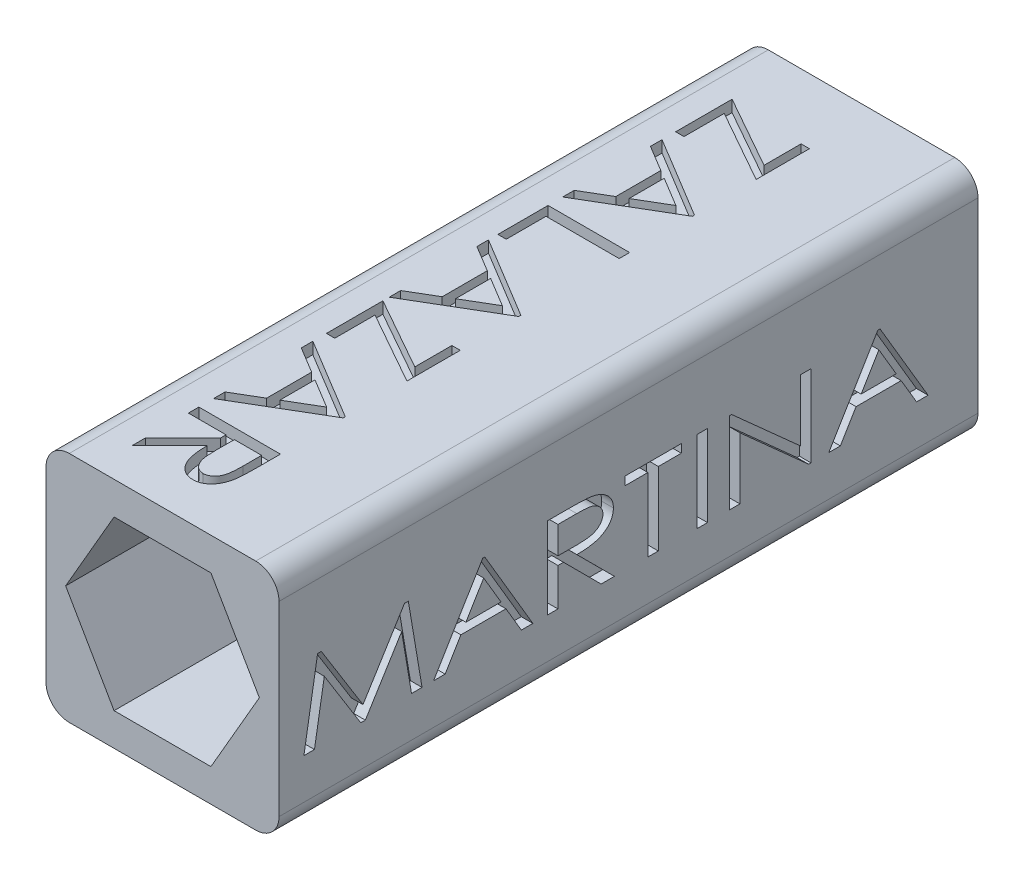
from build123d import *

# Parameters (mm, degrees)
CROQUIS1_W              = 30
CROQUIS1_H              = 10
SALIENTE_EXTRUIR1_DEPTH = 5
REDONDEO2_R             = 1
CORTAR_EXTRUIR3_DEPTH   = 16.5
CROQUIS6_W              = 0.448717949
CROQUIS6_H              = 3.5
CORTAR_EXTRUIR4_DEPTH   = 0.5
CORTAR_EXTRUIR5_DEPTH   = 0.5
CROQUIS9_W              = 0.448717949
CROQUIS9_H              = 3.5
CORTAR_EXTRUIR8_DEPTH   = 0.5
CORTAR_EXTRUIR9_DEPTH   = 0.5


with BuildPart() as part:
    # Croquis1 → Saliente-Extruir1 (new, symmetric)
    with BuildSketch(Plane(origin=(0, 0, 0), x_dir=(0, 0, -1), z_dir=(1, 0, 0))):
        Rectangle(CROQUIS1_W, CROQUIS1_H)
    extrude(amount=SALIENTE_EXTRUIR1_DEPTH, both=True)

    # Redondeo2
    redondeo2_edges = [part.edges().sort_by_distance(p)[0] for p in [
        (5, -5, 0),
        (-5, -5, 0),
        (-5, 5, 0),
        (5, 5, 0),
    ]]
    fillet(redondeo2_edges, radius=REDONDEO2_R)

    # Croquis5 → Cortar-Extruir3 (cut, symmetric)
    with BuildSketch(Plane.XY):
        Polygon((4.156921938, 0), (2.078460969, 3.6), (-2.078460969, 3.6), (-4.156921938, 0), (-2.078460969, -3.6), (2.078460969, -3.6), align=None)
    extrude(amount=CORTAR_EXTRUIR3_DEPTH, both=True, mode=Mode.SUBTRACT)

    # Croquis6 → Cortar-Extruir4 (cut)
    # profile 1 of 7: a face of its own
    with BuildSketch(Plane(origin=(5, 0, 0), x_dir=(0, 0, -1), z_dir=(1, 0, 0))):
        Polygon((-13.930690227, -2.26543463), (-13.343150163, 1.23456537), (-13.183995516, 1.23456537), (-11.395433817, -1.637229501), (-9.613883336, 1.23456537), (-9.449119715, 1.23456537), (-8.860177407, -2.26543463), (-9.312400965, -2.26543463), (-9.735177407, 0.247385883), (-11.293771157, -2.26543463), (-11.490085259, -2.26543463), (-13.055690227, 0.247385883), (-13.477765548, -2.26543463), align=None)
    # profile 2 of 7: a face of its own
    with BuildSketch(Plane(origin=(5, 0, 0), x_dir=(0, 0, -1), z_dir=(1, 0, 0))):
        Polygon((-6.167869715, 1.23456537), (-4.10376715, -2.26543463), (-4.598058016, -2.26543463), (-5.25991699, -1.143639758), (-7.1936109, -1.143639758), (-7.870193433, -2.26543463), (-8.366587663, -2.26543463), (-6.257613304, 1.23456537), align=None)
        Polygon((-6.216247118, 0.478756076), (-6.977665388, -0.784665399), (-5.47095465, -0.784665399), align=None, mode=Mode.SUBTRACT)
    # profile 3 of 7: a face of its own
    with BuildSketch(Plane(origin=(5, 0, 0), x_dir=(0, 0, -1), z_dir=(1, 0, 0))):
        with BuildLine():
            Line((-3.475562022, 1.23456537), (-2.575321638, 1.23456537))
            add(Edge.make_bspline(
                [(-2.575321638, 1.23456537), (-2.515025397, 1.234411626), (-2.399570414, 1.234117236), (-2.234079306, 1.232434592), (-2.083825924, 1.227675496), (-1.948676376, 1.223568584), (-1.828815457, 1.216068884), (-1.724013773, 1.208946876), (-1.634402865, 1.199492992), (-1.579934793, 1.190826403), (-1.555189426, 1.186889088)],
                knots=[0, 0, 0, 0, 1.415751681, 2.71087525, 3.885633551, 4.945392006, 5.885335126, 6.705178082, 7.411750013, 8, 8, 8, 8], degree=3))
            add(Edge.make_bspline(
                [(-1.555189426, 1.186889088), (-1.522369163, 1.180560729), (-1.457637141, 1.168079187), (-1.364008815, 1.141967766), (-1.275060656, 1.110945918), (-1.190548246, 1.075262456), (-1.110773054, 1.03411514), (-1.036027449, 0.987310893), (-0.96549265, 0.936317637), (-0.900848951, 0.87965279), (-0.841509352, 0.819373534), (-0.789499705, 0.755373977), (-0.746594762, 0.686972252), (-0.710145817, 0.616211797), (-0.683390884, 0.541273098), (-0.662076389, 0.463653491), (-0.651462266, 0.382059708), (-0.649588088, 0.326636052), (-0.648638945, 0.298567774)],
                knots=[0, 0, 0, 0, 1.158060629, 2.284064747, 3.365091822, 4.421222022, 5.460948966, 6.472368042, 7.475220723, 8.474173216, 9.447915892, 10.404254337, 11.325545736, 12.242017605, 13.156877323, 14.078311139, 15.026796495, 16, 16, 16, 16], degree=3))
            add(Edge.make_bspline(
                [(-0.648638945, 0.298567774), (-0.649144564, 0.274933931), (-0.65014406, 0.22821506), (-0.659099445, 0.159355784), (-0.671959336, 0.092615202), (-0.691331826, 0.02819017), (-0.715580432, -0.034143631), (-0.746270839, -0.094242025), (-0.781873518, -0.152164122), (-0.822617269, -0.208005338), (-0.869189785, -0.260202308), (-0.919540569, -0.310412637), (-0.97519761, -0.356432823), (-1.035089346, -0.399826655), (-1.100546495, -0.4384955), (-1.170001669, -0.475388325), (-1.24441674, -0.508006509), (-1.323627186, -0.537936382), (-1.409225058, -0.563633288), (-1.501935429, -0.587228727), (-1.60281558, -0.605286319), (-1.711003885, -0.621740449), (-1.82680855, -0.634114729), (-1.950506505, -0.643134433), (-2.081914236, -0.648759039), (-2.172170962, -0.649612432), (-2.218450644, -0.650050014)],
                knots=[0, 0, 0, 0, 0.826279717, 1.633371927, 2.425336346, 3.201275721, 3.983049309, 4.761739642, 5.558079588, 6.359230036, 7.175910982, 8.002514128, 8.844019441, 9.699269509, 10.586691504, 11.500819991, 12.448683489, 13.426494359, 14.46082898, 15.573082518, 16.770735063, 18.043582902, 19.400390649, 20.843035942, 22.381247582, 24, 24, 24, 24], degree=3))
            Line((-2.218450644, -0.650050014), (-0.60376715, -2.26543463))
            Line((-0.60376715, -2.26543463), (-1.174480291, -2.26543463))
            Line((-1.174480291, -2.26543463), (-2.789163785, -0.650050014))
            Line((-2.789163785, -0.650050014), (-3.026844074, -0.650050014))
            Line((-3.026844074, -0.650050014), (-3.026844074, -2.26543463))
            Line((-3.026844074, -2.26543463), (-3.475562022, -2.26543463))
            Line((-3.475562022, -2.26543463), (-3.475562022, 1.23456537))
        make_face()
        with BuildLine():
            Line((-3.026844074, 0.875591011), (-3.026844074, -0.291075655))
            Line((-3.026844074, -0.291075655), (-2.239484298, -0.295983508))
            add(Edge.make_bspline(
                [(-2.239484298, -0.295983508), (-2.202553961, -0.296000479), (-2.131245206, -0.296033249), (-2.028181109, -0.292025235), (-1.932542399, -0.28750289), (-1.8441593, -0.280491019), (-1.763213224, -0.271641792), (-1.68975612, -0.260427143), (-1.62372963, -0.247269735), (-1.546690587, -0.227316643), (-1.460618167, -0.195682626), (-1.367331395, -0.149293455), (-1.28735132, -0.090923237), (-1.219431949, -0.024259727), (-1.165520274, 0.049773715), (-1.125863338, 0.128968785), (-1.101755766, 0.212798662), (-1.098827007, 0.27037034), (-1.097356894, 0.299268896)],
                knots=[0, 0, 0, 0, 1.231620994, 2.378135913, 3.439647445, 4.424894905, 5.33476534, 6.154973974, 6.902513896, 7.579370968, 8.807410044, 9.954348853, 11.04265389, 12.095429027, 13.116681689, 14.082307565, 15.037399197, 16, 16, 16, 16], degree=3))
            add(Edge.make_bspline(
                [(-1.097356894, 0.299268896), (-1.09882915, 0.327470915), (-1.10176313, 0.383673218), (-1.125961258, 0.46572743), (-1.166063435, 0.54322585), (-1.221403587, 0.614719074), (-1.287317686, 0.680924133), (-1.365577245, 0.736160376), (-1.452766978, 0.782473137), (-1.533697264, 0.811417317), (-1.606018766, 0.829695584), (-1.669171279, 0.842289694), (-1.740566774, 0.852570858), (-1.820351636, 0.86073949), (-1.908465758, 0.867849508), (-2.005032397, 0.872539586), (-2.109992597, 0.875397404), (-2.18269138, 0.875524709), (-2.220554009, 0.875591011)],
                knots=[0, 0, 0, 0, 0.958499453, 1.910142575, 2.884874514, 3.912561374, 4.97559375, 6.052815496, 7.159385708, 8.326885406, 8.967379471, 9.697429774, 10.517478787, 11.421351305, 12.426725265, 13.525808778, 14.711403655, 16, 16, 16, 16], degree=3))
            Line((-2.220554009, 0.875591011), (-3.026844074, 0.875591011))
        make_face(mode=Mode.SUBTRACT)
    # profile 4 of 7: a face of its own
    with BuildSketch(Plane(origin=(5, 0, 0), x_dir=(0, 0, -1), z_dir=(1, 0, 0))):
        Polygon((-0.155049202, 0.875591011), (-0.155049202, 1.23456537), (2.268027721, 1.23456537), (2.268027721, 0.875591011), (1.280848234, 0.875591011), (1.280848234, -2.26543463), (0.832130285, -2.26543463), (0.832130285, 0.875591011), align=None)
    # profile 5 of 7: a face of its own
    with BuildSketch(Plane(origin=(5, 0, 0), x_dir=(0, 0, -1), z_dir=(1, 0, 0))):
        with Locations((3.165463619, -0.51543463)):
            Rectangle(CROQUIS6_W, CROQUIS6_H)
    # profile 6 of 7: a face of its own
    with BuildSketch(Plane(origin=(5, 0, 0), x_dir=(0, 0, -1), z_dir=(1, 0, 0))):
        Polygon((4.332130285, -2.26543463), (4.332130285, 1.23456537), (4.426781728, 1.23456537), (7.383412337, -1.412870527), (7.383412337, 1.23456537), (7.832130285, 1.23456537), (7.832130285, -2.26543463), (7.729766503, -2.26543463), (4.780848234, 0.375691172), (4.780848234, -2.26543463), align=None)
    # profile 7 of 7: a face of its own
    with BuildSketch(Plane(origin=(5, 0, 0), x_dir=(0, 0, -1), z_dir=(1, 0, 0))):
        Polygon((10.793668747, 1.23456537), (12.857771311, -2.26543463), (12.363480446, -2.26543463), (11.701621471, -1.143639758), (9.767927561, -1.143639758), (9.091345029, -2.26543463), (8.594950798, -2.26543463), (10.703925157, 1.23456537), align=None)
        Polygon((10.745291343, 0.478756076), (9.983873074, -0.784665399), (11.490583811, -0.784665399), align=None, mode=Mode.SUBTRACT)
    extrude(amount=-CORTAR_EXTRUIR4_DEPTH, mode=Mode.SUBTRACT)

    # Croquis7 → Cortar-Extruir5 (cut)
    # profile 1 of 7: a face of its own
    with BuildSketch(Plane.XZ.offset(5)):
        Polygon((0.628106556, 13.397646785), (0.987080915, 13.397646785), (0.987080915, 11.109185247), (-2.153944726, 12.880218901), (-2.153944726, 11.154057042), (-2.512919085, 11.154057042), (-2.512919085, 13.577133965), (0.628106556, 11.806100311), align=None)
    # profile 2 of 7: a face of its own
    with BuildSketch(Plane.XZ.offset(5)):
        Polygon((0.987080915, 8.37200576), (-2.512919085, 6.307903195), (-2.512919085, 6.802194061), (-1.391124213, 7.464053035), (-1.391124213, 9.397746945), (-2.512919085, 10.074329477), (-2.512919085, 10.570723708), (0.987080915, 8.461749349), align=None)
        Polygon((0.23127162, 8.420383163), (-1.032149854, 9.181801433), (-1.032149854, 7.675090695), align=None, mode=Mode.SUBTRACT)
    # profile 3 of 7: a face of its own
    with BuildSketch(Plane.XZ.offset(5)):
        Polygon((0.987080915, 5.679698067), (0.987080915, 5.230980118), (-2.153944726, 5.230980118), (-2.153944726, 3.525851913), (-2.512919085, 3.525851913), (-2.512919085, 5.679698067), align=None)
    # profile 4 of 7: a face of its own
    with BuildSketch(Plane.XZ.offset(5)):
        Polygon((0.987080915, 0.923287811), (-2.512919085, -1.140814753), (-2.512919085, -0.646523888), (-1.391124213, 0.015335086), (-1.391124213, 1.949028997), (-2.512919085, 2.625611529), (-2.512919085, 3.12200576), (0.987080915, 1.013031401), align=None)
        Polygon((0.23127162, 0.971665215), (-1.032149854, 1.733083484), (-1.032149854, 0.226372747), align=None, mode=Mode.SUBTRACT)
    # profile 5 of 7: a face of its own
    with BuildSketch(Plane.XZ.offset(5)):
        Polygon((0.628106556, -1.589532702), (0.987080915, -1.589532702), (0.987080915, -3.87799424), (-2.153944726, -2.106960587), (-2.153944726, -3.833122446), (-2.512919085, -3.833122446), (-2.512919085, -1.410045523), (0.628106556, -3.181079176), align=None)
    # profile 6 of 7: a face of its own
    with BuildSketch(Plane.XZ.offset(5)):
        Polygon((0.987080915, -6.615173728), (-2.512919085, -8.679276292), (-2.512919085, -8.184985426), (-1.391124213, -7.523126452), (-1.391124213, -5.589432542), (-2.512919085, -4.91285001), (-2.512919085, -4.416455779), (0.987080915, -6.525430138), align=None)
        Polygon((0.23127162, -6.566796324), (-1.032149854, -5.805378055), (-1.032149854, -7.312088792), align=None, mode=Mode.SUBTRACT)
    # profile 7 of 7: a face of its own
    with BuildSketch(Plane.XZ.offset(5)):
        with BuildLine():
            Line((0.987080915, -9.30748142), (0.987080915, -10.207721805))
            add(Edge.make_bspline(
                [(0.987080915, -10.207721805), (0.98692717, -10.268018045), (0.986632781, -10.383473028), (0.984950136, -10.548964136), (0.98019104, -10.699217518), (0.976084128, -10.834367066), (0.968584429, -10.954227985), (0.96146242, -11.05902967), (0.952008537, -11.148640577), (0.943341948, -11.20310865), (0.939404633, -11.227854016)],
                knots=[0, 0, 0, 0, 1.415751681, 2.71087525, 3.885633551, 4.945392006, 5.885335126, 6.705178082, 7.411750013, 8, 8, 8, 8], degree=3))
            add(Edge.make_bspline(
                [(0.939404633, -11.227854016), (0.933076044, -11.260674139), (0.92059405, -11.325405883), (0.894485908, -11.419036218), (0.863452238, -11.507977136), (0.827811384, -11.592515645), (0.786418035, -11.672372738), (0.740048738, -11.747618715), (0.688817463, -11.8182521), (0.632126932, -11.88283352), (0.57216706, -11.942371459), (0.507390545, -11.993282183), (0.439964817, -12.037539672), (0.368315264, -12.072420213), (0.294105905, -12.100845692), (0.216013867, -12.120648913), (0.134600529, -12.131666171), (0.079160094, -12.133483928), (0.051083319, -12.134404497)],
                knots=[0, 0, 0, 0, 1.157816548, 2.283583341, 3.364382571, 4.420290173, 5.459797977, 6.477887418, 7.48052873, 8.479270676, 9.45280812, 10.403890314, 11.329355895, 12.242013004, 13.159507648, 14.078716168, 15.027001614, 16, 16, 16, 16], degree=3))
            add(Edge.make_bspline(
                [(0.051083319, -12.134404497), (0.027449476, -12.133898878), (-0.019269396, -12.132899382), (-0.08812867, -12.123943996), (-0.154869256, -12.111084108), (-0.219294273, -12.091711608), (-0.281628133, -12.067463043), (-0.341726306, -12.036772482), (-0.399649248, -12.001170388), (-0.455487255, -11.960424417), (-0.50769649, -11.913860386), (-0.557860046, -11.863477245), (-0.604181064, -11.807797577), (-0.646861631, -11.747422994), (-0.68623166, -11.682419602), (-0.722827205, -11.613013452), (-0.755507274, -11.538635497), (-0.785402321, -11.459410423), (-0.811245288, -11.373616363), (-0.834507169, -11.280828226), (-0.852880025, -11.180015945), (-0.86919902, -11.072034814), (-0.881647384, -10.956005552), (-0.890559895, -10.832299305), (-0.896265497, -10.70089679), (-0.897103608, -10.610872847), (-0.897534469, -10.564592798)],
                knots=[0, 0, 0, 0, 0.82629536, 1.63340285, 2.425382263, 3.201336329, 3.983124717, 4.761829792, 5.558184815, 6.35935043, 7.176046838, 8.002665633, 8.844186878, 9.706107795, 10.586553567, 11.500699361, 12.448580803, 13.426410186, 14.460764388, 15.580971395, 16.77061285, 18.043484787, 19.400318222, 20.851143476, 22.381216936, 24, 24, 24, 24], degree=3))
            Line((-0.897534469, -10.564592798), (-2.512919085, -12.179276292))
            Line((-2.512919085, -12.179276292), (-2.512919085, -11.608563151))
            Line((-2.512919085, -11.608563151), (-0.897534469, -9.993879657))
            Line((-0.897534469, -9.993879657), (-0.897534469, -9.756199369))
            Line((-0.897534469, -9.756199369), (-2.512919085, -9.756199369))
            Line((-2.512919085, -9.756199369), (-2.512919085, -9.30748142))
            Line((-2.512919085, -9.30748142), (0.987080915, -9.30748142))
        make_face()
        with BuildLine():
            Line((0.628106556, -9.756199369), (-0.538560111, -9.756199369))
            Line((-0.538560111, -9.756199369), (-0.543467963, -10.543559144))
            add(Edge.make_bspline(
                [(-0.543467963, -10.543559144), (-0.543484934, -10.580489481), (-0.543517704, -10.651798236), (-0.539509692, -10.754862334), (-0.534987343, -10.850501041), (-0.527975484, -10.938884152), (-0.519126213, -11.019830187), (-0.507911707, -11.093287422), (-0.494753836, -11.15931349), (-0.47480269, -11.236354305), (-0.443155841, -11.322415044), (-0.396815272, -11.415746053), (-0.338178967, -11.495708812), (-0.271965726, -11.564265401), (-0.197875988, -11.618359582), (-0.118326545, -11.657019541), (-0.03470824, -11.681335286), (0.022878383, -11.684232346), (0.051784441, -11.685686548)],
                knots=[0, 0, 0, 0, 1.231457874, 2.377820945, 3.439191887, 4.424308858, 5.334058786, 6.154158789, 6.901599705, 7.578367131, 8.806243563, 9.953030467, 11.041191366, 12.099381154, 13.120498559, 14.08256155, 15.037526687, 16, 16, 16, 16], degree=3))
            add(Edge.make_bspline(
                [(0.051784441, -11.685686548), (0.079983454, -11.684210534), (0.136179768, -11.681269062), (0.218279013, -11.65712726), (0.295474183, -11.616867633), (0.367719718, -11.562432698), (0.433164483, -11.495677665), (0.488743364, -11.417523777), (0.534795505, -11.330429061), (0.564035929, -11.249853437), (0.582200683, -11.177721476), (0.594804123, -11.114574202), (0.605139643, -11.042949437), (0.613204392, -10.962920228), (0.620374861, -10.874578686), (0.625052186, -10.778010744), (0.627913785, -10.67305093), (0.62804054, -10.600352092), (0.628106556, -10.562489433)],
                knots=[0, 0, 0, 0, 0.95842031, 1.909984854, 2.88463631, 3.907456375, 4.976069263, 6.053202063, 7.159680905, 8.31960957, 8.960050749, 9.690040772, 10.510022073, 11.421729365, 12.427020311, 13.526013072, 14.711510055, 16, 16, 16, 16], degree=3))
            Line((0.628106556, -10.562489433), (0.628106556, -9.756199369))
        make_face(mode=Mode.SUBTRACT)
    extrude(amount=-CORTAR_EXTRUIR5_DEPTH, mode=Mode.SUBTRACT)

    # Croquis9 → Cortar-Extruir8 (cut)
    # profile 1 of 7: a face of its own
    with BuildSketch(Plane.ZY.offset(5)):
        Polygon((-12.812838238, -2.465205317), (-12.225298173, 1.034794683), (-12.066143526, 1.034794683), (-10.277581827, -1.837000189), (-8.496031347, 1.034794683), (-8.331267725, 1.034794683), (-7.742325417, -2.465205317), (-8.194548975, -2.465205317), (-8.617325417, 0.047615196), (-10.175919167, -2.465205317), (-10.37223327, -2.465205317), (-11.937838238, 0.047615196), (-12.359913558, -2.465205317), align=None)
    # profile 2 of 7: a face of its own
    with BuildSketch(Plane.ZY.offset(5)):
        Polygon((-5.050017725, 1.034794683), (-2.985915161, -2.465205317), (-3.480206026, -2.465205317), (-4.142065, -1.343410445), (-6.075758911, -1.343410445), (-6.752341443, -2.465205317), (-7.248735673, -2.465205317), (-5.139761314, 1.034794683), align=None)
        Polygon((-5.098395129, 0.278985388), (-5.859813398, -0.984436086), (-4.353102661, -0.984436086), align=None, mode=Mode.SUBTRACT)
    # profile 3 of 7: a face of its own
    with BuildSketch(Plane.ZY.offset(5)):
        with BuildLine():
            Line((-2.357710032, 1.034794683), (-1.457469648, 1.034794683))
            add(Edge.make_bspline(
                [(-1.457469648, 1.034794683), (-1.397173407, 1.034640938), (-1.281718424, 1.034346549), (-1.116227316, 1.032663904), (-0.965973934, 1.027904808), (-0.830824386, 1.023797896), (-0.710963467, 1.016298197), (-0.606161783, 1.009176188), (-0.516550875, 0.999722305), (-0.462082803, 0.991055715), (-0.437337436, 0.987118401)],
                knots=[0, 0, 0, 0, 1.415751681, 2.71087525, 3.885633551, 4.945392006, 5.885335126, 6.705178082, 7.411750013, 8, 8, 8, 8], degree=3))
            add(Edge.make_bspline(
                [(-0.437337436, 0.987118401), (-0.404517173, 0.980790042), (-0.339785151, 0.9683085), (-0.246156825, 0.942197078), (-0.157208666, 0.91117523), (-0.072696256, 0.875491769), (0.007078936, 0.834344453), (0.081824541, 0.787540205), (0.15235934, 0.73654695), (0.217003039, 0.679882103), (0.276342638, 0.619602847), (0.328352285, 0.555603289), (0.371257228, 0.487201565), (0.407706173, 0.41644111), (0.434461106, 0.341502411), (0.455775601, 0.263882803), (0.466389724, 0.18228902), (0.468263902, 0.126865364), (0.469213045, 0.098797087)],
                knots=[0, 0, 0, 0, 1.158060629, 2.284064747, 3.365091822, 4.421222022, 5.460948966, 6.472368042, 7.475220723, 8.474173216, 9.447915892, 10.404254337, 11.325545736, 12.242017605, 13.156877323, 14.078311139, 15.026796495, 16, 16, 16, 16], degree=3))
            add(Edge.make_bspline(
                [(0.469213045, 0.098797087), (0.468707426, 0.075163244), (0.46770793, 0.028444372), (0.458752545, -0.040414903), (0.445892653, -0.107155485), (0.426520164, -0.171580517), (0.402271558, -0.233914318), (0.37158115, -0.294012713), (0.335978472, -0.35193481), (0.295234721, -0.407776026), (0.248662205, -0.459972995), (0.19831142, -0.510183325), (0.14265438, -0.556203511), (0.082762643, -0.599597342), (0.017305495, -0.638266188), (-0.052149679, -0.675159012), (-0.12656475, -0.707777197), (-0.205775197, -0.737707069), (-0.291373068, -0.763403975), (-0.38408344, -0.786999414), (-0.48496359, -0.805057007), (-0.593151896, -0.821511137), (-0.70895656, -0.833885416), (-0.832654516, -0.842905121), (-0.964062246, -0.848529726), (-1.054318972, -0.849383119), (-1.100598654, -0.849820702)],
                knots=[0, 0, 0, 0, 0.826279717, 1.633371927, 2.425336346, 3.201275721, 3.983049309, 4.761739642, 5.558079588, 6.359230036, 7.175910982, 8.002514128, 8.844019441, 9.699269509, 10.586691504, 11.500819991, 12.448683489, 13.426494359, 14.46082898, 15.573082518, 16.770735063, 18.043582902, 19.400390649, 20.843035942, 22.381247582, 24, 24, 24, 24], degree=3))
            Line((-1.100598654, -0.849820702), (0.514084839, -2.465205317))
            Line((0.514084839, -2.465205317), (-0.056628302, -2.465205317))
            Line((-0.056628302, -2.465205317), (-1.671311795, -0.849820702))
            Line((-1.671311795, -0.849820702), (-1.908992084, -0.849820702))
            Line((-1.908992084, -0.849820702), (-1.908992084, -2.465205317))
            Line((-1.908992084, -2.465205317), (-2.357710032, -2.465205317))
            Line((-2.357710032, -2.465205317), (-2.357710032, 1.034794683))
        make_face()
        with BuildLine():
            Line((-1.908992084, 0.675820324), (-1.908992084, -0.490846343))
            Line((-1.908992084, -0.490846343), (-1.121632308, -0.495754195))
            add(Edge.make_bspline(
                [(-1.121632308, -0.495754195), (-1.084701971, -0.495771166), (-1.013393216, -0.495803936), (-0.910329119, -0.491795923), (-0.814690409, -0.487273578), (-0.72630731, -0.480261706), (-0.645361234, -0.471412479), (-0.57190413, -0.46019783), (-0.50587764, -0.447040422), (-0.428838597, -0.42708733), (-0.342766177, -0.395453313), (-0.249479405, -0.349064142), (-0.16949933, -0.290693925), (-0.10157996, -0.224030414), (-0.047668284, -0.149996972), (-0.008011348, -0.070801902), (0.016096224, 0.013027974), (0.019024983, 0.070599652), (0.020495096, 0.099498209)],
                knots=[0, 0, 0, 0, 1.231620994, 2.378135913, 3.439647445, 4.424894905, 5.33476534, 6.154973974, 6.902513896, 7.579370968, 8.807410044, 9.954348853, 11.04265389, 12.095429027, 13.116681689, 14.082307565, 15.037399197, 16, 16, 16, 16], degree=3))
            add(Edge.make_bspline(
                [(0.020495096, 0.099498209), (0.01902284, 0.127700228), (0.01608886, 0.183902531), (-0.008109268, 0.265956743), (-0.048211445, 0.343455163), (-0.103551598, 0.414948387), (-0.169465696, 0.481153446), (-0.247725255, 0.536389688), (-0.334914988, 0.58270245), (-0.415845275, 0.61164663), (-0.488166776, 0.629924897), (-0.551319289, 0.642519006), (-0.622714784, 0.652800171), (-0.702499646, 0.660968803), (-0.790613769, 0.668078821), (-0.887180407, 0.672768898), (-0.992140608, 0.675626717), (-1.06483939, 0.675754022), (-1.10270202, 0.675820324)],
                knots=[0, 0, 0, 0, 0.958499453, 1.910142575, 2.884874514, 3.912561374, 4.97559375, 6.052815496, 7.159385708, 8.326885406, 8.967379471, 9.697429774, 10.517478787, 11.421351305, 12.426725265, 13.525808778, 14.711403655, 16, 16, 16, 16], degree=3))
            Line((-1.10270202, 0.675820324), (-1.908992084, 0.675820324))
        make_face(mode=Mode.SUBTRACT)
    # profile 4 of 7: a face of its own
    with BuildSketch(Plane.ZY.offset(5)):
        Polygon((0.962802788, 0.675820324), (0.962802788, 1.034794683), (3.385879711, 1.034794683), (3.385879711, 0.675820324), (2.398700224, 0.675820324), (2.398700224, -2.465205317), (1.949982275, -2.465205317), (1.949982275, 0.675820324), align=None)
    # profile 5 of 7: a face of its own
    with BuildSketch(Plane.ZY.offset(5)):
        with Locations((4.283315609, -0.715205317)):
            Rectangle(CROQUIS9_W, CROQUIS9_H)
    # profile 6 of 7: a face of its own
    with BuildSketch(Plane.ZY.offset(5)):
        Polygon((5.449982275, -2.465205317), (5.449982275, 1.034794683), (5.544633718, 1.034794683), (8.501264327, -1.612641214), (8.501264327, 1.034794683), (8.949982275, 1.034794683), (8.949982275, -2.465205317), (8.847618493, -2.465205317), (5.898700224, 0.175920484), (5.898700224, -2.465205317), align=None)
    # profile 7 of 7: a face of its own
    with BuildSketch(Plane.ZY.offset(5)):
        Polygon((11.911520737, 1.034794683), (13.975623301, -2.465205317), (13.481332436, -2.465205317), (12.819473461, -1.343410445), (10.885779551, -1.343410445), (10.209197019, -2.465205317), (9.712802788, -2.465205317), (11.821777147, 1.034794683), align=None)
        Polygon((11.863143333, 0.278985388), (11.101725064, -0.984436086), (12.608435801, -0.984436086), align=None, mode=Mode.SUBTRACT)
    extrude(amount=-CORTAR_EXTRUIR8_DEPTH, mode=Mode.SUBTRACT)

    # Croquis10 → Cortar-Extruir9 (cut)
    # profile 1 of 7: a face of its own
    with BuildSketch(Plane(origin=(0, 5, 0), x_dir=(1, 0, 0), z_dir=(0, 1, 0))):
        with BuildLine():
            Line((0.555950951, -10.494441768), (0.555950951, -11.394682152))
            add(Edge.make_bspline(
                [(0.555950951, -11.394682152), (0.555797206, -11.454978393), (0.555502816, -11.570433376), (0.553820172, -11.735924484), (0.549061076, -11.886177866), (0.544954164, -12.021327414), (0.537454465, -12.141188333), (0.530332456, -12.245990018), (0.520878572, -12.335600925), (0.512211983, -12.390068998), (0.508274669, -12.414814364)],
                knots=[0, 0, 0, 0, 1.415751681, 2.71087525, 3.885633551, 4.945392006, 5.885335126, 6.705178082, 7.411750013, 8, 8, 8, 8], degree=3))
            add(Edge.make_bspline(
                [(0.508274669, -12.414814364), (0.50194608, -12.447634487), (0.489464085, -12.512366231), (0.463355943, -12.605996566), (0.432322273, -12.694937484), (0.396681419, -12.779475993), (0.35528807, -12.859333086), (0.308918773, -12.934579063), (0.257687498, -13.005212448), (0.200996967, -13.069793867), (0.141037096, -13.129331807), (0.07626058, -13.180242531), (0.008834852, -13.22450002), (-0.062814701, -13.259380561), (-0.137024059, -13.28780604), (-0.215116098, -13.307609261), (-0.296529436, -13.318626519), (-0.351969871, -13.320444276), (-0.380046646, -13.321364845)],
                knots=[0, 0, 0, 0, 1.157816548, 2.283583341, 3.364382571, 4.420290173, 5.459797977, 6.477887418, 7.48052873, 8.479270676, 9.45280812, 10.403890314, 11.329355895, 12.242013004, 13.159507648, 14.078716168, 15.027001614, 16, 16, 16, 16], degree=3))
            add(Edge.make_bspline(
                [(-0.380046646, -13.321364845), (-0.403680489, -13.320859226), (-0.45039936, -13.31985973), (-0.519258635, -13.310904344), (-0.585999221, -13.298044456), (-0.650424237, -13.278671956), (-0.712758098, -13.254423391), (-0.77285627, -13.22373283), (-0.830779213, -13.188130736), (-0.886617219, -13.147384765), (-0.938826454, -13.100820734), (-0.98899001, -13.050437593), (-1.035311029, -12.994757925), (-1.077991595, -12.934383342), (-1.117361624, -12.86937995), (-1.153957169, -12.7999738), (-1.186637238, -12.725595845), (-1.216532286, -12.646370771), (-1.242375252, -12.56057671), (-1.265637133, -12.467788573), (-1.28400999, -12.366976293), (-1.300328984, -12.258995161), (-1.312777348, -12.142965899), (-1.32168986, -12.019259653), (-1.327395462, -11.887857138), (-1.328233573, -11.797833195), (-1.328664434, -11.751553146)],
                knots=[0, 0, 0, 0, 0.82629536, 1.63340285, 2.425382263, 3.201336329, 3.983124717, 4.761829792, 5.558184815, 6.35935043, 7.176046838, 8.002665633, 8.844186878, 9.706107795, 10.586553567, 11.500699361, 12.448580803, 13.426410186, 14.460764388, 15.580971395, 16.77061285, 18.043484787, 19.400318222, 20.851143476, 22.381216936, 24, 24, 24, 24], degree=3))
            Line((-1.328664434, -11.751553146), (-2.944049049, -13.36623664))
            Line((-2.944049049, -13.36623664), (-2.944049049, -12.795523499))
            Line((-2.944049049, -12.795523499), (-1.328664434, -11.180840005))
            Line((-1.328664434, -11.180840005), (-1.328664434, -10.943159717))
            Line((-1.328664434, -10.943159717), (-2.944049049, -10.943159717))
            Line((-2.944049049, -10.943159717), (-2.944049049, -10.494441768))
            Line((-2.944049049, -10.494441768), (0.555950951, -10.494441768))
        make_face()
        with BuildLine():
            Line((0.196976592, -10.943159717), (-0.969690075, -10.943159717))
            Line((-0.969690075, -10.943159717), (-0.974597928, -11.730519492))
            add(Edge.make_bspline(
                [(-0.974597928, -11.730519492), (-0.974614899, -11.767449829), (-0.974647668, -11.838758584), (-0.970639656, -11.941822682), (-0.966117307, -12.037461388), (-0.959105449, -12.125844499), (-0.950256178, -12.206790535), (-0.939041672, -12.280247769), (-0.9258838, -12.346273838), (-0.905932655, -12.423314652), (-0.874285806, -12.509375392), (-0.827945236, -12.602706401), (-0.769308931, -12.68266916), (-0.70309569, -12.751225749), (-0.629005952, -12.80531993), (-0.549456509, -12.843979889), (-0.465838204, -12.868295633), (-0.408251582, -12.871192694), (-0.379345524, -12.872646896)],
                knots=[0, 0, 0, 0, 1.231457874, 2.377820945, 3.439191887, 4.424308858, 5.334058786, 6.154158789, 6.901599705, 7.578367131, 8.806243563, 9.953030467, 11.041191366, 12.099381154, 13.120498559, 14.08256155, 15.037526687, 16, 16, 16, 16], degree=3))
            add(Edge.make_bspline(
                [(-0.379345524, -12.872646896), (-0.35114651, -12.871170881), (-0.294950196, -12.86822941), (-0.212850951, -12.844087608), (-0.135655782, -12.803827981), (-0.063410247, -12.749393046), (0.002034518, -12.682638013), (0.0576134, -12.604484125), (0.10366554, -12.517389408), (0.132905964, -12.436813784), (0.151070719, -12.364681824), (0.163674159, -12.30153455), (0.174009679, -12.229909785), (0.182074428, -12.149880576), (0.189244897, -12.061539034), (0.193922222, -11.964971092), (0.19678382, -11.860011278), (0.196910576, -11.787312439), (0.196976592, -11.749449781)],
                knots=[0, 0, 0, 0, 0.95842031, 1.909984854, 2.88463631, 3.907456375, 4.976069263, 6.053202063, 7.159680905, 8.31960957, 8.960050749, 9.690040772, 10.510022073, 11.421729365, 12.427020311, 13.526013072, 14.711510055, 16, 16, 16, 16], degree=3))
            Line((0.196976592, -11.749449781), (0.196976592, -10.943159717))
        make_face(mode=Mode.SUBTRACT)
    # profile 2 of 7: a face of its own
    with BuildSketch(Plane(origin=(0, 5, 0), x_dir=(1, 0, 0), z_dir=(0, 1, 0))):
        Polygon((0.555950951, -7.802134076), (-2.944049049, -9.86623664), (-2.944049049, -9.371945774), (-1.822254178, -8.7100868), (-1.822254178, -6.77639289), (-2.944049049, -6.099810358), (-2.944049049, -5.603416127), (0.555950951, -7.712390486), align=None)
        Polygon((-0.199858344, -7.753756672), (-1.463279819, -6.992338402), (-1.463279819, -8.49904914), align=None, mode=Mode.SUBTRACT)
    # profile 3 of 7: a face of its own
    with BuildSketch(Plane(origin=(0, 5, 0), x_dir=(1, 0, 0), z_dir=(0, 1, 0))):
        Polygon((0.196976592, -2.77649305), (0.555950951, -2.77649305), (0.555950951, -5.064954588), (-2.58507469, -3.293920935), (-2.58507469, -5.020082793), (-2.944049049, -5.020082793), (-2.944049049, -2.59700587), (0.196976592, -4.368039524), align=None)
    # profile 4 of 7: a face of its own
    with BuildSketch(Plane(origin=(0, 5, 0), x_dir=(1, 0, 0), z_dir=(0, 1, 0))):
        Polygon((0.555950951, -0.263672537), (-2.944049049, -2.327775101), (-2.944049049, -1.833484236), (-1.822254178, -1.171625261), (-1.822254178, 0.762068649), (-2.944049049, 1.438651181), (-2.944049049, 1.935045412), (0.555950951, -0.173928947), align=None)
        Polygon((-0.199858344, -0.215295133), (-1.463279819, 0.546123136), (-1.463279819, -0.960587601), align=None, mode=Mode.SUBTRACT)
    # profile 5 of 7: a face of its own
    with BuildSketch(Plane(origin=(0, 5, 0), x_dir=(1, 0, 0), z_dir=(0, 1, 0))):
        Polygon((0.555950951, 4.492737719), (0.555950951, 4.044019771), (-2.58507469, 4.044019771), (-2.58507469, 2.338891565), (-2.944049049, 2.338891565), (-2.944049049, 4.492737719), align=None)
    # profile 6 of 7: a face of its own
    with BuildSketch(Plane(origin=(0, 5, 0), x_dir=(1, 0, 0), z_dir=(0, 1, 0))):
        Polygon((0.555950951, 7.185045412), (-2.944049049, 5.120942848), (-2.944049049, 5.615233713), (-1.822254178, 6.277092687), (-1.822254178, 8.210786598), (-2.944049049, 8.88736913), (-2.944049049, 9.38376336), (0.555950951, 7.274789001), align=None)
        Polygon((-0.199858344, 7.233422815), (-1.463279819, 7.994841085), (-1.463279819, 6.488130348), align=None, mode=Mode.SUBTRACT)
    # profile 7 of 7: a face of its own
    with BuildSketch(Plane(origin=(0, 5, 0), x_dir=(1, 0, 0), z_dir=(0, 1, 0))):
        Polygon((0.196976592, 12.210686437), (0.555950951, 12.210686437), (0.555950951, 9.922224899), (-2.58507469, 11.693258553), (-2.58507469, 9.967096694), (-2.944049049, 9.967096694), (-2.944049049, 12.390173617), (0.196976592, 10.619139963), align=None)
    extrude(amount=-CORTAR_EXTRUIR9_DEPTH, mode=Mode.SUBTRACT)


solid = part.part
